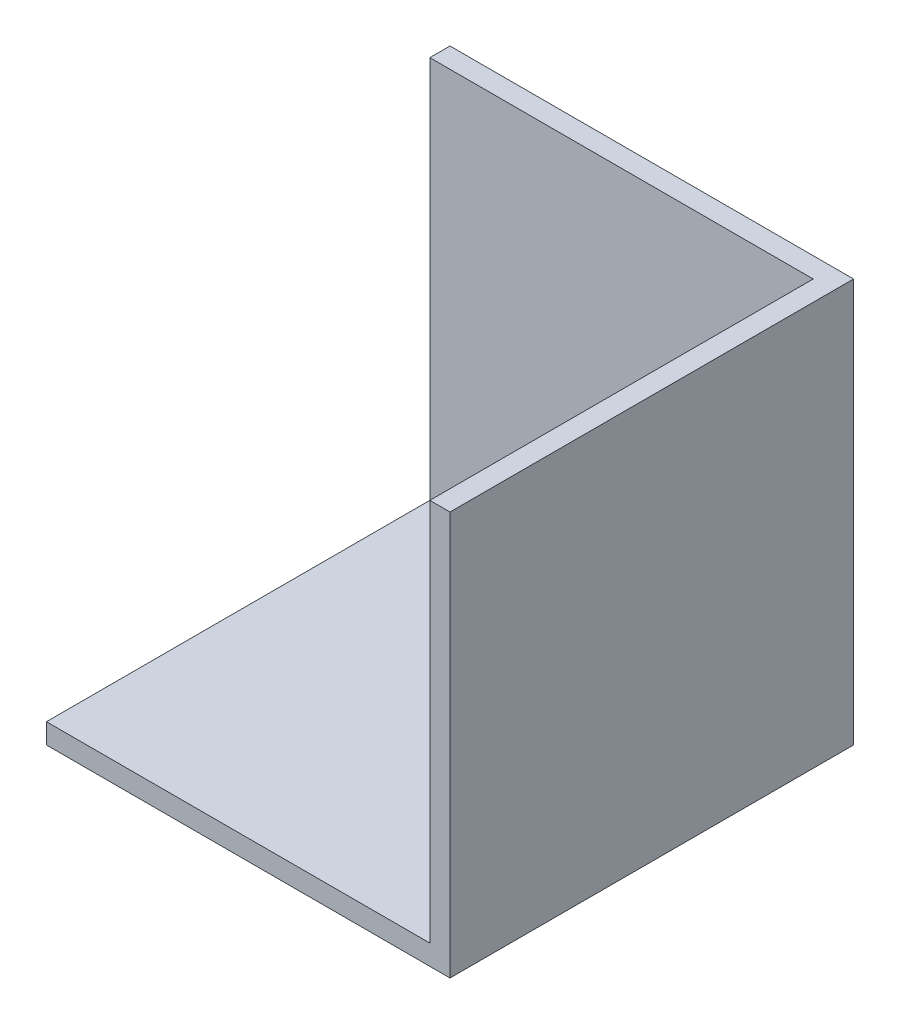
from build123d import *

# Parameters (mm, degrees)
SKETCH1_W           = 100
SKETCH1_H           = 100
BOSS_EXTRUDE1_DEPTH = 5
BOSS_EXTRUDE4_DEPTH = 95
SKETCH5_W           = 16
SKETCH5_H           = 16
BOSS_EXTRUDE6_DEPTH = 20
SKETCH8_W           = 13
SKETCH8_H           = 13
CUT_EXTRUDE2_DEPTH  = 20
SKETCH9_R           = 2
CUT_EXTRUDE3_DEPTH  = 5


with BuildPart() as part:
    # Sketch1 → Boss-Extrude1 (new body)
    with BuildSketch(Plane.XY):
        Rectangle(SKETCH1_W, SKETCH1_H)
    extrude(amount=BOSS_EXTRUDE1_DEPTH)

    # Sketch4 → Boss-Extrude4 (add)
    with BuildSketch(Plane.XY.offset(5)):
        Polygon((50, 50), (50, -50), (-50, -50), (-50, -45), (45, -45), (45, 50), align=None)
    extrude(amount=BOSS_EXTRUDE4_DEPTH)

    # Sketch5 → Boss-Extrude6 (add)
    with BuildSketch(Plane.ZY.offset(-45)):
        with Locations((50, 10)):
            Rectangle(SKETCH5_W, SKETCH5_H)
    extrude(amount=BOSS_EXTRUDE6_DEPTH)

    # Sketch8 → Cut-Extrude2 (cut)
    with BuildSketch(Plane.ZY.offset(-25)):
        with Locations((50, 10)):
            Rectangle(SKETCH8_W, SKETCH8_H)
    extrude(amount=-CUT_EXTRUDE2_DEPTH, mode=Mode.SUBTRACT)

    # Sketch9 → Cut-Extrude3 (cut)
    with BuildSketch(Plane(origin=(0, 18, 0), x_dir=(1, 0, 0), z_dir=(0, 1, 0))):
        with Locations(Location((39.3, -49.816402155, 0), (0, 0, 180))):
            Circle(SKETCH9_R)
        with Locations(Location((29.3, -49.816402155, 0), (0, 0, 180))):
            Circle(SKETCH9_R)
    extrude(amount=-CUT_EXTRUDE3_DEPTH, mode=Mode.SUBTRACT)


solid = part.part
